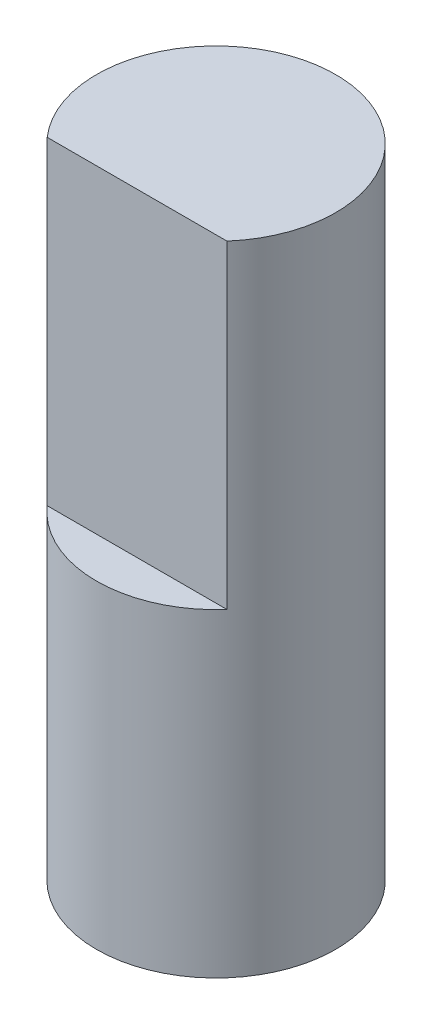
from build123d import *

# Parameters (mm, degrees)
SKETCH1_R           = 1.5
BOSS_EXTRUDE1_DEPTH = 8
CUT_EXTRUDE1_START  = -4
CUT_EXTRUDE1_DEPTH  = 4


with BuildPart() as part:
    # Sketch1 → Boss-Extrude1 (new body)
    with BuildSketch(Plane(origin=(0, 0, 0), x_dir=(1, 0, 0), z_dir=(0, 1, 0))):
        with Locations(Location((0, 0, 0), (0, 0, 270))):
            Circle(SKETCH1_R)
    extrude(amount=BOSS_EXTRUDE1_DEPTH)

    # Sketch2 → Cut-Extrude1 (cut)
    with BuildSketch(Plane(origin=(0, 8, 0), x_dir=(1, 0, 0), z_dir=(0, 1, 0)).offset(CUT_EXTRUDE1_START)):
        with BuildLine():
            Line((-1.126421796, -0.990542244), (1.126421796, -0.990542244))
            ThreePointArc((1.126421796, -0.990542244), (0, -1.5), (-1.126421796, -0.990542244))
        make_face()
    extrude(amount=CUT_EXTRUDE1_DEPTH, mode=Mode.SUBTRACT)


solid = part.part
